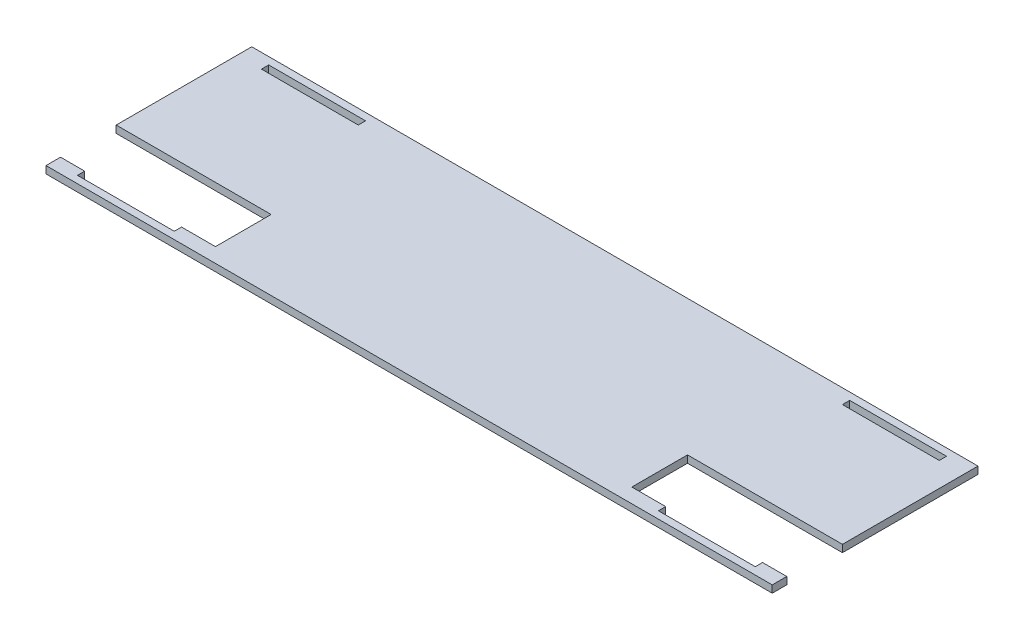
from build123d import *

# Parameters (mm, degrees)
SKETCH1_W           = 300
SKETCH1_H           = 85
BOSS_EXTRUDE1_DEPTH = 3
SKETCH2_W           = 40
SKETCH2_H           = 3
CUT_EXTRUDE1_DEPTH  = 3
SKETCH3_W           = 40
SKETCH3_H           = 3
CUT_EXTRUDE2_DEPTH  = 3
SKETCH4_W           = 40
SKETCH4_H           = 3
CUT_EXTRUDE3_DEPTH  = 3
SKETCH5_W           = 40
SKETCH5_H           = 3
CUT_EXTRUDE4_DEPTH  = 3
SKETCH6_W           = 64
SKETCH6_H           = 23
CUT_EXTRUDE6_DEPTH  = 3
SKETCH7_W           = 64
SKETCH7_H           = 23
CUT_EXTRUDE7_DEPTH  = 3


with BuildPart() as part:
    # Sketch1 → Boss-Extrude1 (new body)
    with BuildSketch(Plane(origin=(0, 0, 0), x_dir=(1, 0, 0), z_dir=(0, 1, 0))):
        with Locations((-150, 42.5)):
            Rectangle(SKETCH1_W, SKETCH1_H)
    extrude(amount=BOSS_EXTRUDE1_DEPTH)

    # Sketch2 → Cut-Extrude1 (cut)
    with BuildSketch(Plane(origin=(0, 3, 0), x_dir=(1, 0, 0), z_dir=(0, 1, 0))):
        with Locations((-270, 4.5)):
            Rectangle(SKETCH2_W, SKETCH2_H)
    extrude(amount=-CUT_EXTRUDE1_DEPTH, mode=Mode.SUBTRACT)

    # Sketch3 → Cut-Extrude2 (cut)
    with BuildSketch(Plane(origin=(0, 3, 0), x_dir=(1, 0, 0), z_dir=(0, 1, 0))):
        with Locations((-30, 4.5)):
            Rectangle(SKETCH3_W, SKETCH3_H)
    extrude(amount=-CUT_EXTRUDE2_DEPTH, mode=Mode.SUBTRACT)

    # Sketch4 → Cut-Extrude3 (cut)
    with BuildSketch(Plane(origin=(0, 3, 0), x_dir=(1, 0, 0), z_dir=(0, 1, 0))):
        with Locations((-30, 80.5)):
            Rectangle(SKETCH4_W, SKETCH4_H)
    extrude(amount=-CUT_EXTRUDE3_DEPTH, mode=Mode.SUBTRACT)

    # Sketch5 → Cut-Extrude4 (cut)
    with BuildSketch(Plane(origin=(0, 3, 0), x_dir=(1, 0, 0), z_dir=(0, 1, 0))):
        with Locations((-270, 80.5)):
            Rectangle(SKETCH5_W, SKETCH5_H)
    extrude(amount=-CUT_EXTRUDE4_DEPTH, mode=Mode.SUBTRACT)

    # Sketch6 → Cut-Extrude6 (cut)
    with BuildSketch(Plane(origin=(0, 3, 0), x_dir=(1, 0, 0), z_dir=(0, 1, 0))):
        with Locations((-268, 17.5)):
            Rectangle(SKETCH6_W, SKETCH6_H)
    extrude(amount=-CUT_EXTRUDE6_DEPTH, mode=Mode.SUBTRACT)

    # Sketch7 → Cut-Extrude7 (cut)
    with BuildSketch(Plane(origin=(0, 3, 0), x_dir=(1, 0, 0), z_dir=(0, 1, 0))):
        with Locations((-32, 17.5)):
            Rectangle(SKETCH7_W, SKETCH7_H)
    extrude(amount=-CUT_EXTRUDE7_DEPTH, mode=Mode.SUBTRACT)


solid = part.part
